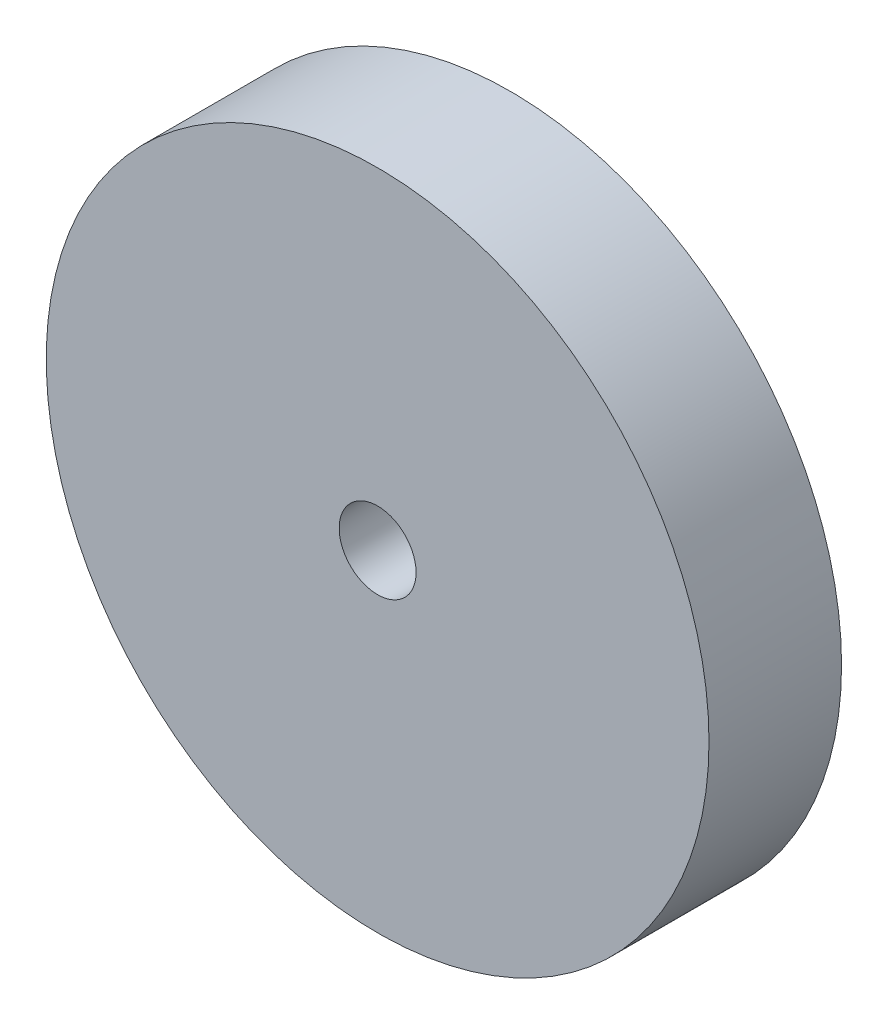
from build123d import *

# Parameters (mm, degrees)
SKETCH1_R           = 12.7
BOSS_EXTRUDE1_DEPTH = 5.08
SKETCH2_R           = 1.4732
CUT_EXTRUDE1_DEPTH  = 19.66511184


with BuildPart() as part:
    # Sketch1 → Boss-Extrude1 (new body)
    with BuildSketch(Plane.XY):
        Circle(SKETCH1_R)
    extrude(amount=BOSS_EXTRUDE1_DEPTH)

    # Sketch2 → Cut-Extrude1 (cut, through all)
    with BuildSketch(Plane.XY.offset(5.08)):
        Circle(SKETCH2_R)
    extrude(amount=-CUT_EXTRUDE1_DEPTH, mode=Mode.SUBTRACT)


solid = part.part
